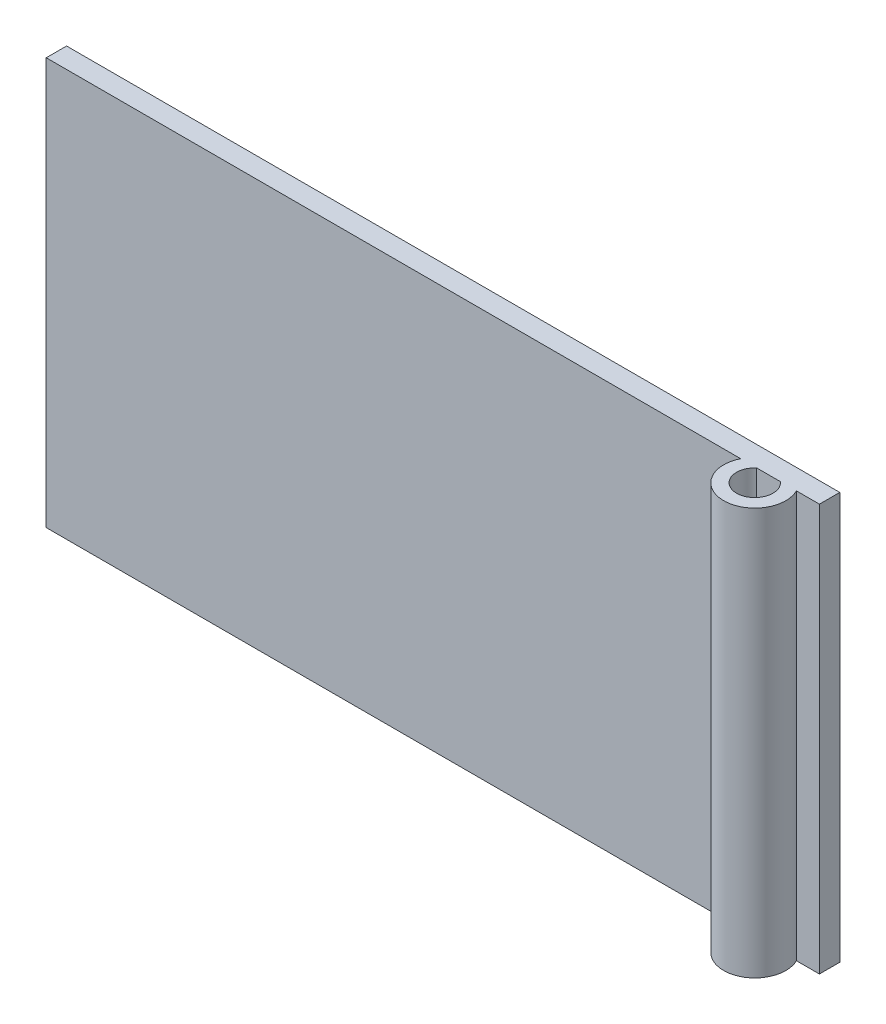
from build123d import *

# Parameters (mm, degrees)
SKETCH1_W                       = 380
SKETCH1_H                       = 200
FOOT_DEPTH                      = 10
BOSS_EXTRUDE2_REACH             = 216.942
SKETCH2_R                       = 15.273641531
SKETCH2_R_2                     = 8.942985805
BOSS_EXTRUDE2_DIRECTION_2_REACH = 216.942


with BuildPart() as part:
    # Sketch1 → Foot (new body)
    with BuildSketch(Plane.XY):
        Rectangle(SKETCH1_W, SKETCH1_H)
    extrude(amount=FOOT_DEPTH)

    # Boss-Extrude2: up to this face of the body (flat: up to its plane)
    boss_extrude2_end = Plane(part.part.faces().sort_by_distance((0, 100, 5))[0])
    # Sketch2 → Boss-Extrude2 (add, up to the picked face)
    with BuildSketch(Plane(origin=(0, 0, 0), x_dir=(1, 0, 0), z_dir=(0, 1, 0)), mode=Mode.PRIVATE) as boss_extrude2_sk1:
        with Locations((165.004857041, -16.778784358)):
            Circle(SKETCH2_R)
        with Locations((165.004857041, -16.778784358)):
            Circle(SKETCH2_R_2, mode=Mode.SUBTRACT)
    boss_extrude2_tool1 = split(extrude(boss_extrude2_sk1.sketch, amount=BOSS_EXTRUDE2_REACH, mode=Mode.PRIVATE), bisect_by=boss_extrude2_end, keep=Keep.BOTH, mode=Mode.PRIVATE)
    add(boss_extrude2_tool1.solids().sort_by(Axis((150.163219, 0, 16.778784), (0, 1, 0)))[0])

    # Boss-Extrude2 direction 2: up to this face of the body (flat: up to its plane)
    boss_extrude2_direction_2_end = Plane(part.part.faces().sort_by_distance((0, -100, 5))[0])
    # Sketch2 → Boss-Extrude2 direction 2 (add, up to the picked face)
    with BuildSketch(Plane(origin=(0, 0, 0), x_dir=(1, 0, 0), z_dir=(0, 1, 0)), mode=Mode.PRIVATE) as boss_extrude2_direction_2_sk1:
        with Locations((165.004857041, -16.778784358)):
            Circle(SKETCH2_R)
        with Locations((165.004857041, -16.778784358)):
            Circle(SKETCH2_R_2, mode=Mode.SUBTRACT)
    boss_extrude2_direction_2_tool1 = split(extrude(boss_extrude2_direction_2_sk1.sketch, amount=-BOSS_EXTRUDE2_DIRECTION_2_REACH, mode=Mode.PRIVATE), bisect_by=boss_extrude2_direction_2_end, keep=Keep.BOTH, mode=Mode.PRIVATE)
    add(boss_extrude2_direction_2_tool1.solids().sort_by(Axis((150.163219, 0, 16.778784), (0, -1, 0)))[0])


solid = part.part
